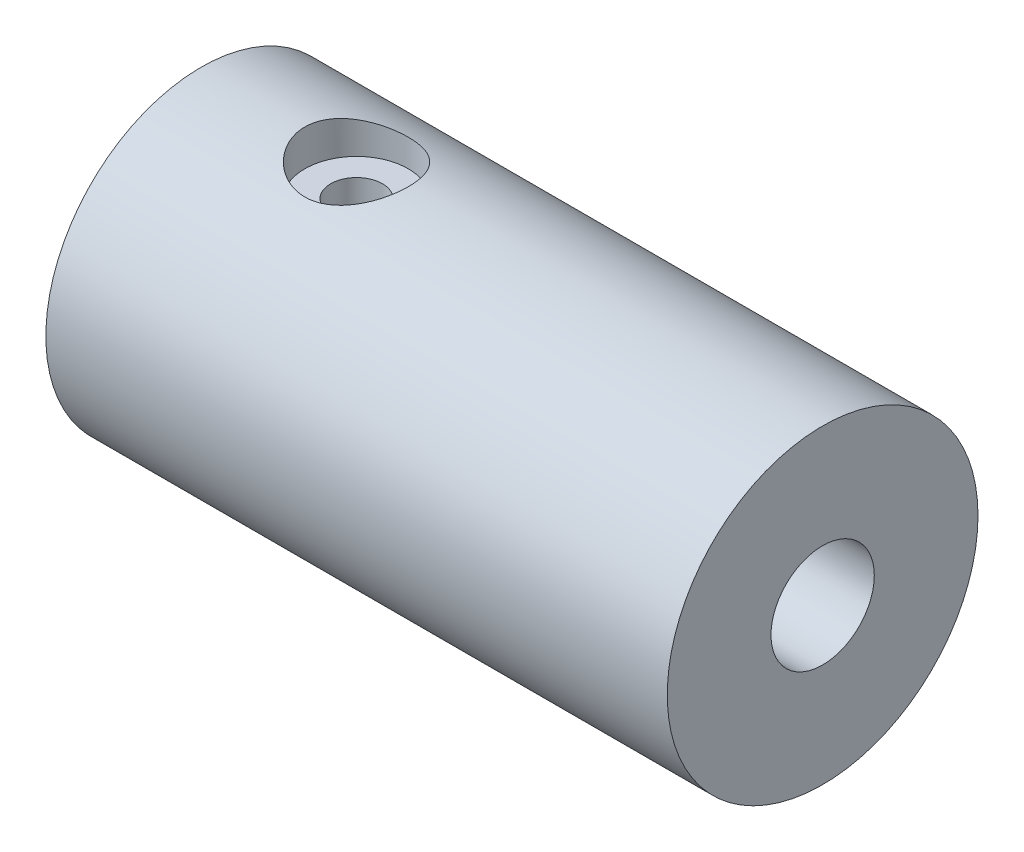
from build123d import *

# Parameters (mm, degrees)
SKETCH1_R               = 3
BOSS_EXTRUDE1_DEPTH     = 12
SKETCH2_R               = 1.095
CUT_EXTRUDE1_DEPTH      = 7
SKETCH3_R               = 1
CUT_EXTRUDE2_DEPTH      = 0.7
CUT_EXTRUDE3_REACH      = 15.599
CUT_EXTRUDE3_END_RADIUS = 1.095
SKETCH4_R               = 0.5
SKETCH5_R               = 0.9975
CUT_EXTRUDE4_DEPTH      = 3


with BuildPart() as part:
    # Sketch1 → Boss-Extrude1 (new body)
    with BuildSketch(Plane(origin=(0, 0, 0), x_dir=(0, 0, -1), z_dir=(1, 0, 0))):
        Circle(SKETCH1_R)
    extrude(amount=BOSS_EXTRUDE1_DEPTH)

    # Sketch2 → Cut-Extrude1 (cut)
    with BuildSketch(Plane(origin=(0, 0, 0), x_dir=(0, 0, -1), z_dir=(1, 0, 0))):
        Circle(SKETCH2_R)
    extrude(amount=CUT_EXTRUDE1_DEPTH, mode=Mode.SUBTRACT)

    # Sketch3 → Cut-Extrude2 (cut)
    with BuildSketch(Plane(origin=(0, 3, 0), x_dir=(1, 0, 0), z_dir=(0, 1, 0))):
        with Locations(Location((3, 0, 0), (0, 0, 270))):
            Circle(SKETCH3_R)
    extrude(amount=-CUT_EXTRUDE2_DEPTH, mode=Mode.SUBTRACT)

    # Cut-Extrude3: up to this cylinder (the profile starts outside it)
    cut_extrude3_end = Plane(origin=(3, 0, 0), z_dir=(-1, 0, 0)) * Cylinder(CUT_EXTRUDE3_END_RADIUS, 34.388, mode=Mode.PRIVATE)
    # Sketch4 → Cut-Extrude3 (cut, up to the surface)
    with BuildSketch(Plane(origin=(0, 2.65, 0), x_dir=(1, 0, 0), z_dir=(0, 1, 0)), mode=Mode.PRIVATE) as cut_extrude3_sk1:
        with Locations(Location((3, 0, 0), (0, 0, 270))):
            Circle(SKETCH4_R)
    cut_extrude3_tool1 = extrude(cut_extrude3_sk1.sketch, amount=-CUT_EXTRUDE3_REACH, mode=Mode.PRIVATE) - cut_extrude3_end
    add(cut_extrude3_tool1.solids().sort_by_distance((3, 2.65, 0))[0], mode=Mode.SUBTRACT)

    # Sketch5 → Cut-Extrude4 (cut)
    with BuildSketch(Plane(origin=(12, 0, 0), x_dir=(0, 0, -1), z_dir=(1, 0, 0))):
        Circle(SKETCH5_R)
    extrude(amount=-CUT_EXTRUDE4_DEPTH, mode=Mode.SUBTRACT)


solid = part.part
